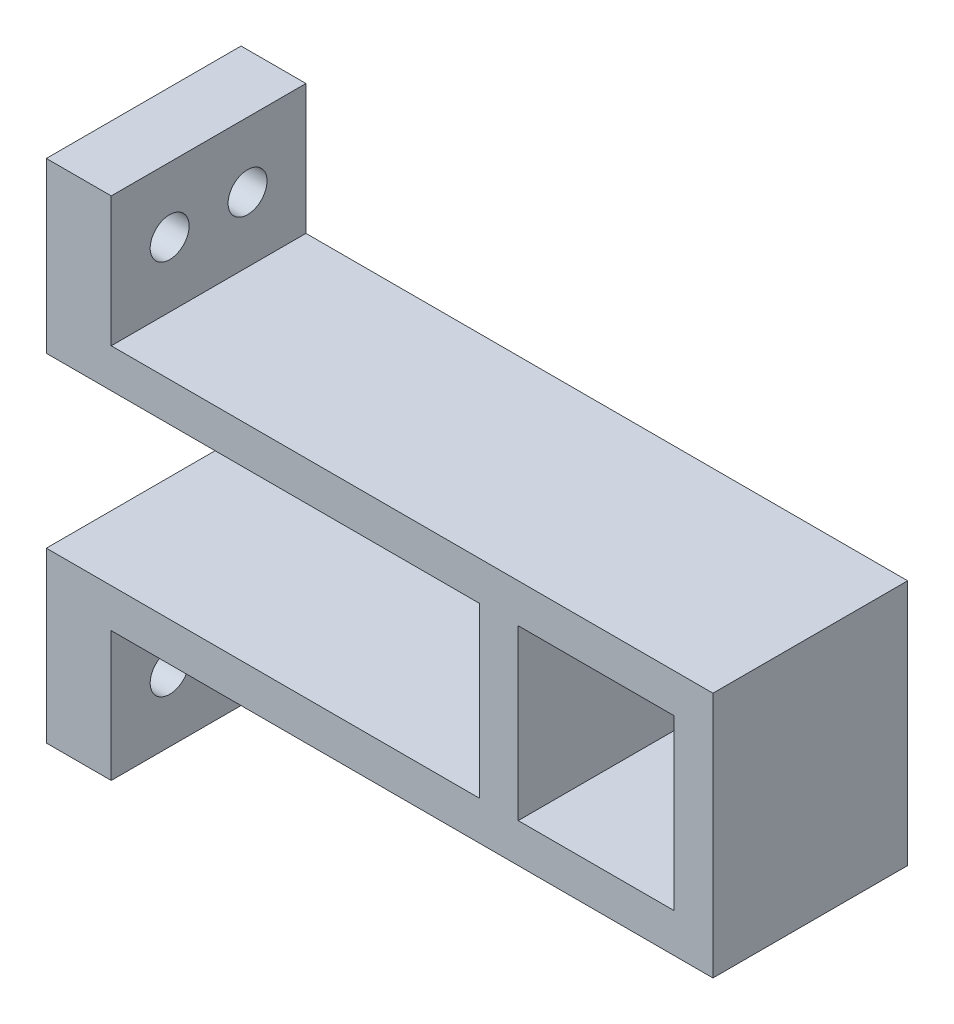
from build123d import *

# Parameters (mm, degrees)
SKETCH1_W             = 15
SKETCH1_H             = 13
SKETCH1_R             = 1.5
BOSS_EXTRUDE1_DEPTH   = 5
BOSS_EXTRUDE1_2_DEPTH = 5
SKETCH2_W             = 15
SKETCH2_H             = 3
BOSS_EXTRUDE2_DEPTH   = 43.35
SKETCH3_W             = 15
SKETCH3_H             = 19
BOSS_EXTRUDE3_DEPTH   = 3
BOSS_EXTRUDE5_START   = -15
SKETCH5_W             = 15
SKETCH5_H             = 19
BOSS_EXTRUDE5_DEPTH   = 3


with BuildPart() as part:
    # Sketch1 → Boss-Extrude1 (new body)
    with BuildSketch(Plane(origin=(0, 0, 0), x_dir=(0, 0, -1), z_dir=(1, 0, 0))):
        with Locations((7.5, 6.5)):
            Rectangle(SKETCH1_W, SKETCH1_H)
        with Locations((4.5, 5)):
            Circle(SKETCH1_R, mode=Mode.SUBTRACT)
        with Locations((10.5, 5)):
            Circle(SKETCH1_R, mode=Mode.SUBTRACT)
    extrude(amount=BOSS_EXTRUDE1_DEPTH)



with BuildPart() as body_2:
    # Sketch1 → Boss-Extrude1 2 (new body)
    with BuildSketch(Plane(origin=(0, 0, 0), x_dir=(0, 0, -1), z_dir=(1, 0, 0))):
        with Locations((7.5, 32.5)):
            Rectangle(SKETCH1_W, SKETCH1_H)
        with Locations((4.5, 34)):
            Circle(SKETCH1_R, mode=Mode.SUBTRACT)
        with Locations((10.5, 34)):
            Circle(SKETCH1_R, mode=Mode.SUBTRACT)
    extrude(amount=BOSS_EXTRUDE1_2_DEPTH)


with BuildPart() as part_1:
    add(part.part)

    add(body_2.part)  # Boss-Extrude2 merges body 2
    # Sketch2 → Boss-Extrude2 (add)
    with BuildSketch(Plane(origin=(5, 0, 0), x_dir=(0, 0, -1), z_dir=(1, 0, 0))):
        with Locations((7.5, 27.5)):
            Rectangle(SKETCH2_W, SKETCH2_H)
        with Locations((7.5, 11.5)):
            Rectangle(SKETCH2_W, SKETCH2_H)
    extrude(amount=BOSS_EXTRUDE2_DEPTH)

    # Sketch3 → Boss-Extrude3 (add)
    with BuildSketch(Plane(origin=(48.35, 0, 0), x_dir=(0, 0, -1), z_dir=(1, 0, 0))):
        with Locations((7.5, 19.5)):
            Rectangle(SKETCH3_W, SKETCH3_H)
    extrude(amount=BOSS_EXTRUDE3_DEPTH)

    # Sketch5 → Boss-Extrude5 (add)
    with BuildSketch(Plane(origin=(51.35, 0, 0), x_dir=(0, 0, -1), z_dir=(1, 0, 0)).offset(BOSS_EXTRUDE5_START)):
        with Locations((7.5, 19.5)):
            Rectangle(SKETCH5_W, SKETCH5_H)
    extrude(amount=-BOSS_EXTRUDE5_DEPTH)


solid = part_1.part
